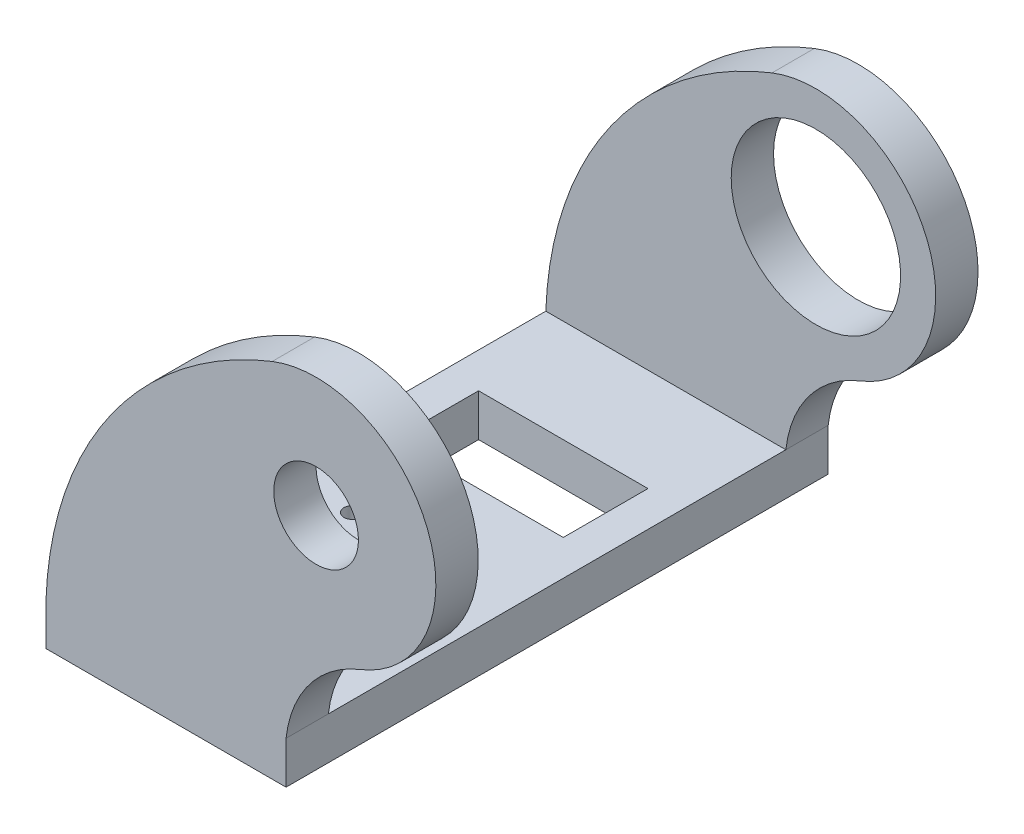
from build123d import *

# Parameters (mm, degrees)
BOSS_EXTRUDE1_DEPTH  = 5
SKETCH2_R            = 5
CUT_EXTRUDE1_DEPTH   = 5
SKETCH4_W            = 28.341926147
SKETCH4_H            = 5
BOSS_EXTRUDE2_DEPTH  = 5
SKETCH5_W            = 28.341926147
SKETCH5_H            = 5
BOSS_EXTRUDE3_DEPTH  = 31.9
SKETCH6_W            = 20
SKETCH6_H            = 5
CUT_EXTRUDE3_DEPTH   = 5
SKETCH8_W            = 4.170963073
SKETCH8_H            = 5
SKETCH8_W_2          = 4.170963074
BOSS_EXTRUDE8_DEPTH  = 10
SKETCH15_W           = 20
SKETCH15_H           = 5
BOSS_EXTRUDE9_DEPTH  = 5
SKETCH18_W           = 28.341926147
SKETCH18_H           = 5
BOSS_EXTRUDE11_DEPTH = 12.11
SKETCH19_R           = 1
CUT_EXTRUDE6_DEPTH   = 12.11
BOSS_EXTRUDE12_START = 5
SKETCH20_R           = 10
BOSS_EXTRUDE12_DEPTH = 5


with BuildPart() as part:
    # Model → Boss-Extrude1 (new body)
    with BuildSketch(Plane.XY):
        with BuildLine():
            Line((25.203972036, 18.418809181), (53.545898183, 18.418809181))
            ThreePointArc((53.545898183, 18.418809181), (56.325296764, 25.33096224), (62.273132312, 29.817182103))
            ThreePointArc((62.273132312, 29.817182103), (70.250885109, 48.157178295), (51.910888918, 56.134931092))
            ThreePointArc((51.910888918, 56.134931092), (32.934484586, 41.258497646), (25.203972036, 18.418809181))
        make_face()
    extrude(amount=BOSS_EXTRUDE1_DEPTH)

    # Sketch2 → Cut-Extrude1 (cut)
    with BuildSketch(Plane.XY.offset(5)):
        with Locations((57.092010615, 42.976056598)):
            Circle(SKETCH2_R)
    extrude(amount=-CUT_EXTRUDE1_DEPTH, mode=Mode.SUBTRACT)

    # Sketch4 → Boss-Extrude2 (add)
    with BuildSketch(Plane.XZ.offset(-18.418809181)):
        with Locations((39.37493511, 2.5)):
            Rectangle(SKETCH4_W, SKETCH4_H)
    extrude(amount=BOSS_EXTRUDE2_DEPTH)

    # Sketch5 → Boss-Extrude3 (add)
    with BuildSketch(Plane(origin=(0, 0, 0), x_dir=(-1, 0, 0), z_dir=(0, 0, -1))):
        with Locations((-39.37493511, 15.918809181)):
            Rectangle(SKETCH5_W, SKETCH5_H)
    extrude(amount=BOSS_EXTRUDE3_DEPTH)

    # Sketch6 → Cut-Extrude3 (cut)
    with BuildSketch(Plane(origin=(0, 18.418809181, 0), x_dir=(1, 0, 0), z_dir=(0, 1, 0))):
        with Locations((39.37493511, 29.4)):
            Rectangle(SKETCH6_W, SKETCH6_H)
    extrude(amount=-CUT_EXTRUDE3_DEPTH, mode=Mode.SUBTRACT)

    # Sketch8 → Boss-Extrude8 (add)
    with BuildSketch(Plane(origin=(0, 0, -31.9), x_dir=(-1, 0, 0), z_dir=(0, 0, -1))):
        with Locations((-51.460416647, 15.918809181)):
            Rectangle(SKETCH8_W, SKETCH8_H)
        with Locations((-27.289453573, 15.918809181)):
            Rectangle(SKETCH8_W_2, SKETCH8_H)
    extrude(amount=BOSS_EXTRUDE8_DEPTH)

    # Sketch15 → Boss-Extrude9 (add)
    with BuildSketch(Plane(origin=(0, 0, -26.9), x_dir=(-1, 0, 0), z_dir=(0, 0, -1))):
        with Locations((-39.37493511, 15.918809181)):
            Rectangle(SKETCH15_W, SKETCH15_H)
    extrude(amount=BOSS_EXTRUDE9_DEPTH)

    # Sketch18 → Boss-Extrude11 (add)
    with BuildSketch(Plane(origin=(0, 0, -41.9), x_dir=(-1, 0, 0), z_dir=(0, 0, -1))):
        with Locations((-39.37493511, 15.918809181)):
            Rectangle(SKETCH18_W, SKETCH18_H)
    extrude(amount=BOSS_EXTRUDE11_DEPTH)

    # Sketch19 → Cut-Extrude6 (cut)
    with BuildSketch(Plane(origin=(0, 18.418809181, 0), x_dir=(1, 0, 0), z_dir=(0, 1, 0))):
        with Locations(Location((34.37493511, 22, 0), (0, 0, 270))):
            Circle(SKETCH19_R)
        with Locations(Location((44.37493511, 22, 0), (0, 0, 270))):
            Circle(SKETCH19_R)
        with Locations(Location((34.37493511, 15, 0), (0, 0, 270))):
            Circle(SKETCH19_R)
        with Locations(Location((44.37493511, 15, 0), (0, 0, 270))):
            Circle(SKETCH19_R)
    extrude(amount=-CUT_EXTRUDE6_DEPTH, mode=Mode.SUBTRACT)

    # Sketch20 → Boss-Extrude12 (add)
    with BuildSketch(Plane(origin=(0, 0, -54.01), x_dir=(-1, 0, 0), z_dir=(0, 0, -1)).offset(BOSS_EXTRUDE12_START)):
        with BuildLine():
            Line((-53.545898183, 18.418809181), (-53.545898183, 13.418809181))
            Line((-53.545898183, 13.418809181), (-25.203972036, 13.418809181))
            Line((-25.203972036, 13.418809181), (-25.203972036, 18.418809181))
            ThreePointArc((-25.203972036, 18.418809181), (-32.934484586, 41.258497646), (-51.910888918, 56.134931092))
            ThreePointArc((-51.910888918, 56.134931092), (-70.250885109, 48.157178295), (-62.273132312, 29.817182103))
            ThreePointArc((-62.273132312, 29.817182103), (-56.325296764, 25.33096224), (-53.545898183, 18.418809181))
        make_face()
        with Locations((-57.092010615, 42.976056598)):
            Circle(SKETCH20_R, mode=Mode.SUBTRACT)
    extrude(amount=-BOSS_EXTRUDE12_DEPTH)


solid = part.part
